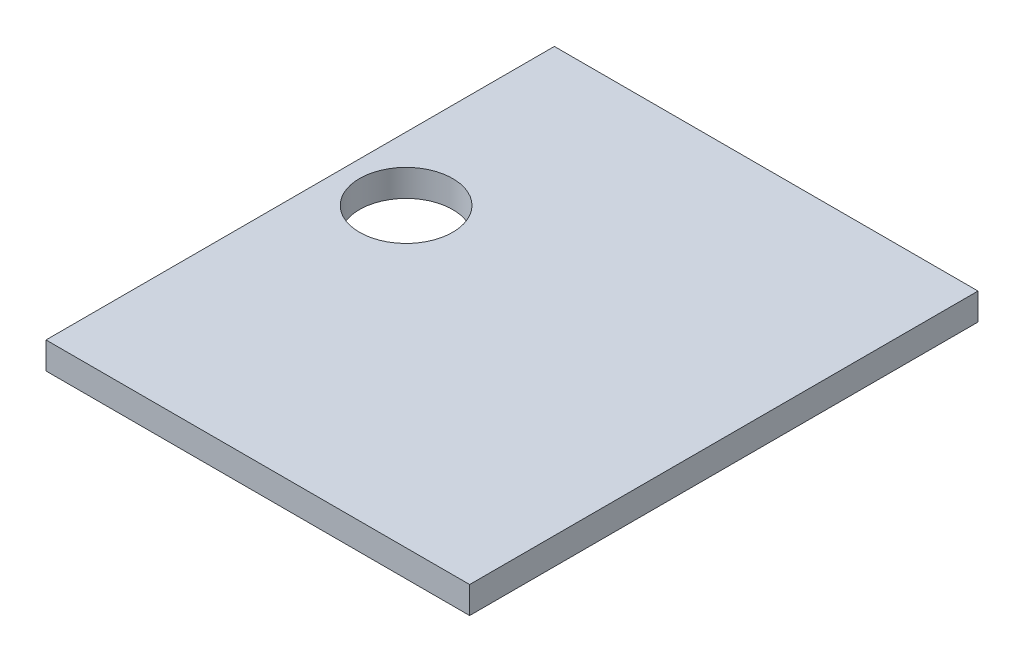
from build123d import *

# Parameters (mm, degrees)
SKETCH1_W           = 100
SKETCH1_H           = 120
SKETCH1_R           = 11
BOSS_EXTRUDE1_DEPTH = 6.35


with BuildPart() as part:
    # Sketch1 → Boss-Extrude1 (new body)
    with BuildSketch(Plane(origin=(0, 0, 0), x_dir=(1, 0, 0), z_dir=(0, 1, 0))):
        with Locations((50, 60)):
            Rectangle(SKETCH1_W, SKETCH1_H)
        with Locations(Location((15, 70, 0), (0, 0, 270))):
            Circle(SKETCH1_R, mode=Mode.SUBTRACT)
    extrude(amount=BOSS_EXTRUDE1_DEPTH)


solid = part.part
